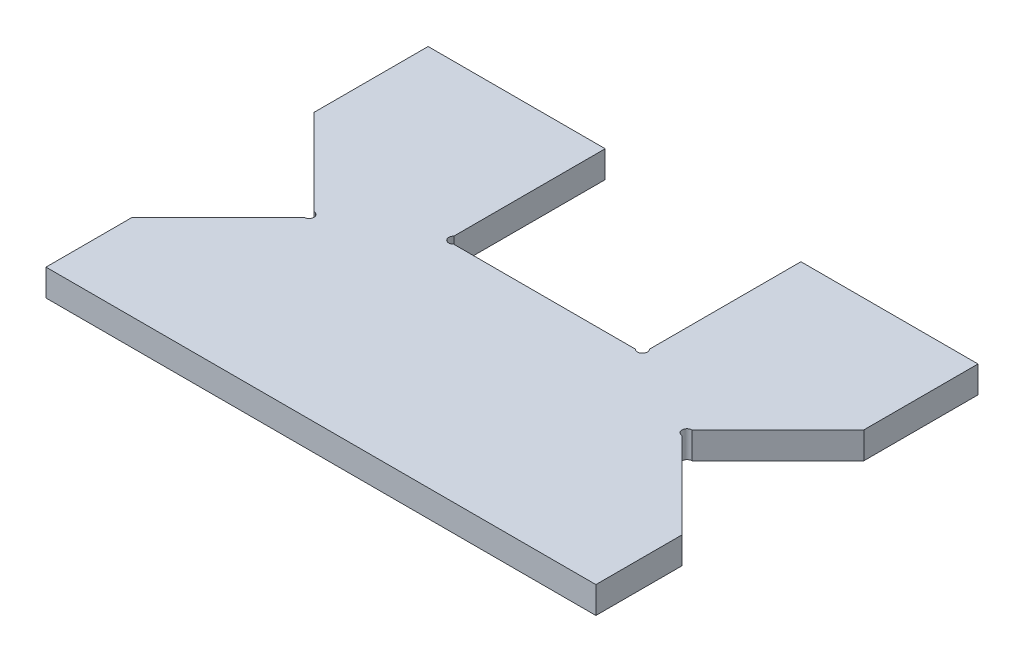
from build123d import *

# Parameters (mm, degrees)
BOSS_EXTRUDE1_DEPTH         = 18.25625
CUT_EXTRUDE1_DEPTH          = 590.645135899
F_1_4_CLEARANCE_HOLE1_D     = 6.7564
F_1_4_CLEARANCE_HOLE1_DEPTH = 18.25625
SKETCH5_W                   = 374.65
SKETCH5_H                   = 298.45
CUT_EXTRUDE2_DEPTH          = 590.645135899


with BuildPart() as part:
    # Sketch1 → Boss-Extrude1 (new body)
    with BuildSketch(Plane(origin=(0, 0, 0), x_dir=(1, 0, 0), z_dir=(0, 1, 0))):
        Polygon((-187.325, -558.8), (187.325, -558.8), (187.325, 0), (66.675, 0), (66.675, -107.95), (-66.675, -107.95), (-66.675, 0), (-187.325, 0), align=None)
    extrude(amount=BOSS_EXTRUDE1_DEPTH)

    # Sketch2 → Cut-Extrude1 (cut, through all)
    with BuildSketch(Plane(origin=(0, 18.25625, 0), x_dir=(1, 0, 0), z_dir=(0, 1, 0))):
        Polygon((-187.325, -201.6125), (-125.4125, -139.7), (-187.325, -77.7875), align=None)
        Polygon((125.4125, -139.7), (187.325, -201.6125), (187.325, -77.7875), align=None)
    extrude(amount=-CUT_EXTRUDE1_DEPTH, mode=Mode.SUBTRACT)

    # 1/4 Clearance Hole1
    with Locations(Plane(origin=(0, 18.25625, 0), x_dir=(1, 0, 0), z_dir=(0, 1, 0))):
        with Locations((-64.29375, -105.56875), (64.29375, -105.56875), (-128.785398023, -139.705301977), (128.785398023, -139.705301977)):
            Hole(F_1_4_CLEARANCE_HOLE1_D / 2, depth=F_1_4_CLEARANCE_HOLE1_DEPTH)

    # Sketch5 → Cut-Extrude2 (cut, through all)
    with BuildSketch(Plane(origin=(0, 18.25625, 0), x_dir=(1, 0, 0), z_dir=(0, 1, 0))):
        with Locations((0, -409.575)):
            Rectangle(SKETCH5_W, SKETCH5_H)
    extrude(amount=-CUT_EXTRUDE2_DEPTH, mode=Mode.SUBTRACT)


solid = part.part
